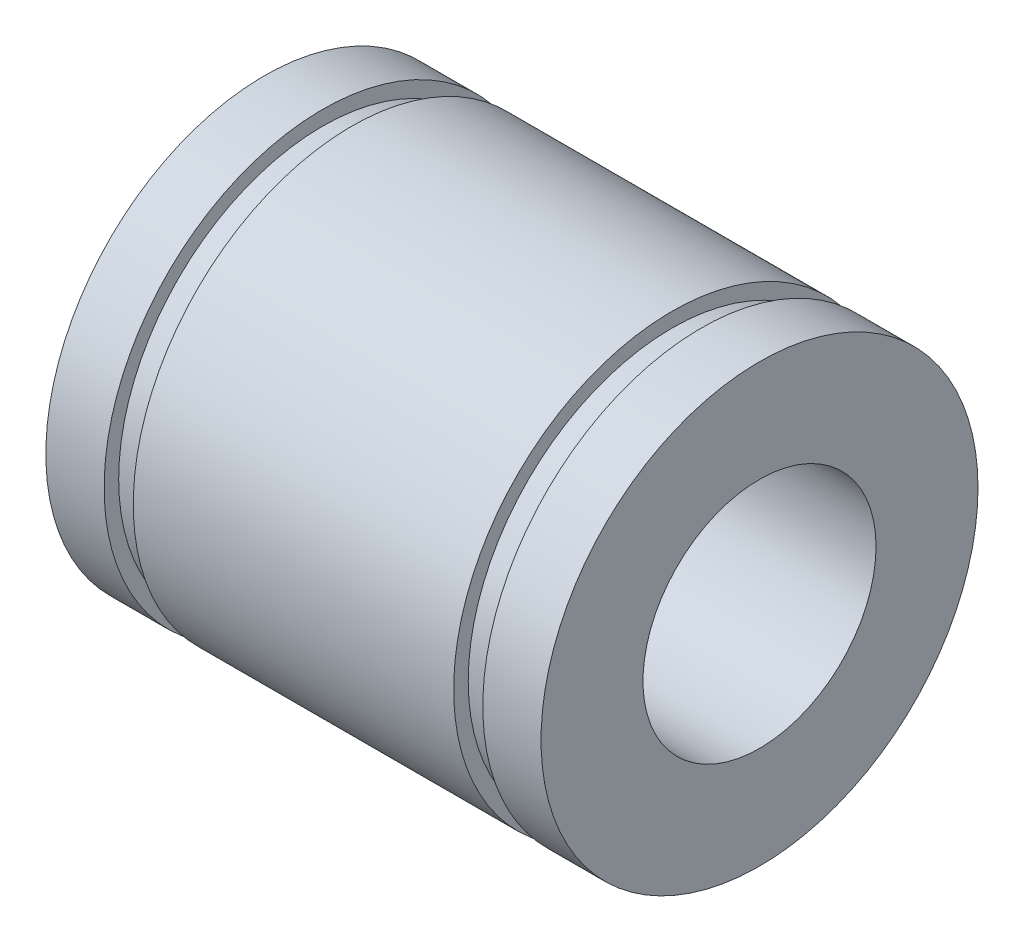
from build123d import *

# Parameters (mm, degrees)
SKETCH1_R           = 7.5
SKETCH1_R_2         = 4
BOSS_EXTRUDE1_DEPTH = 2
SKETCH2_R           = 7
SKETCH2_R_2         = 4
BOSS_EXTRUDE2_DEPTH = 1
SKETCH3_R           = 7.5
SKETCH3_R_2         = 4
BOSS_EXTRUDE3_DEPTH = 11
SKETCH4_R           = 7
SKETCH4_R_2         = 4
BOSS_EXTRUDE4_DEPTH = 1
SKETCH5_R           = 7.5
SKETCH5_R_2         = 4
BOSS_EXTRUDE5_DEPTH = 2


with BuildPart() as part:
    # Sketch1 → Boss-Extrude1 (new body)
    with BuildSketch(Plane(origin=(0, 0, 0), x_dir=(0, 0, -1), z_dir=(1, 0, 0))):
        Circle(SKETCH1_R)
        Circle(SKETCH1_R_2, mode=Mode.SUBTRACT)
    extrude(amount=BOSS_EXTRUDE1_DEPTH)

    # Sketch2 → Boss-Extrude2 (add)
    with BuildSketch(Plane(origin=(2, 0, 0), x_dir=(0, 0, -1), z_dir=(1, 0, 0))):
        Circle(SKETCH2_R)
        Circle(SKETCH2_R_2, mode=Mode.SUBTRACT)
    extrude(amount=BOSS_EXTRUDE2_DEPTH)

    # Sketch3 → Boss-Extrude3 (add)
    with BuildSketch(Plane(origin=(3, 0, 0), x_dir=(0, 0, -1), z_dir=(1, 0, 0))):
        Circle(SKETCH3_R)
        Circle(SKETCH3_R_2, mode=Mode.SUBTRACT)
    extrude(amount=BOSS_EXTRUDE3_DEPTH)

    # Sketch4 → Boss-Extrude4 (add)
    with BuildSketch(Plane(origin=(14, 0, 0), x_dir=(0, 0, -1), z_dir=(1, 0, 0))):
        Circle(SKETCH4_R)
        Circle(SKETCH4_R_2, mode=Mode.SUBTRACT)
    extrude(amount=BOSS_EXTRUDE4_DEPTH)

    # Sketch5 → Boss-Extrude5 (add)
    with BuildSketch(Plane(origin=(15, 0, 0), x_dir=(0, 0, -1), z_dir=(1, 0, 0))):
        Circle(SKETCH5_R)
        Circle(SKETCH5_R_2, mode=Mode.SUBTRACT)
    extrude(amount=BOSS_EXTRUDE5_DEPTH)


solid = part.part
